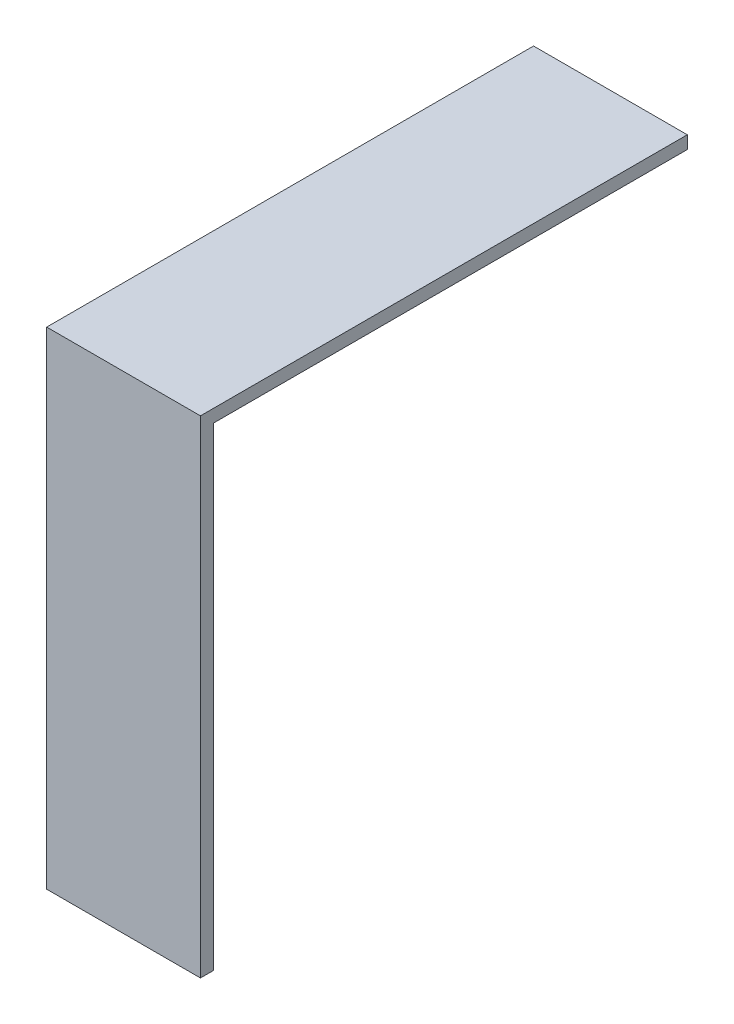
from build123d import *

# Parameters (mm, degrees)
BOSS_EXTRUDE1_DEPTH = 38.1


with BuildPart() as part:
    # Sketch1 → Boss-Extrude1 (new body)
    with BuildSketch(Plane(origin=(0, 0, 0), x_dir=(0, 0, -1), z_dir=(1, 0, 0))):
        Polygon((0, 0), (0, 120.65), (120.65, 120.65), (120.65, 117.475), (3.175, 117.475), (3.175, 0), align=None)
    extrude(amount=BOSS_EXTRUDE1_DEPTH)


solid = part.part
